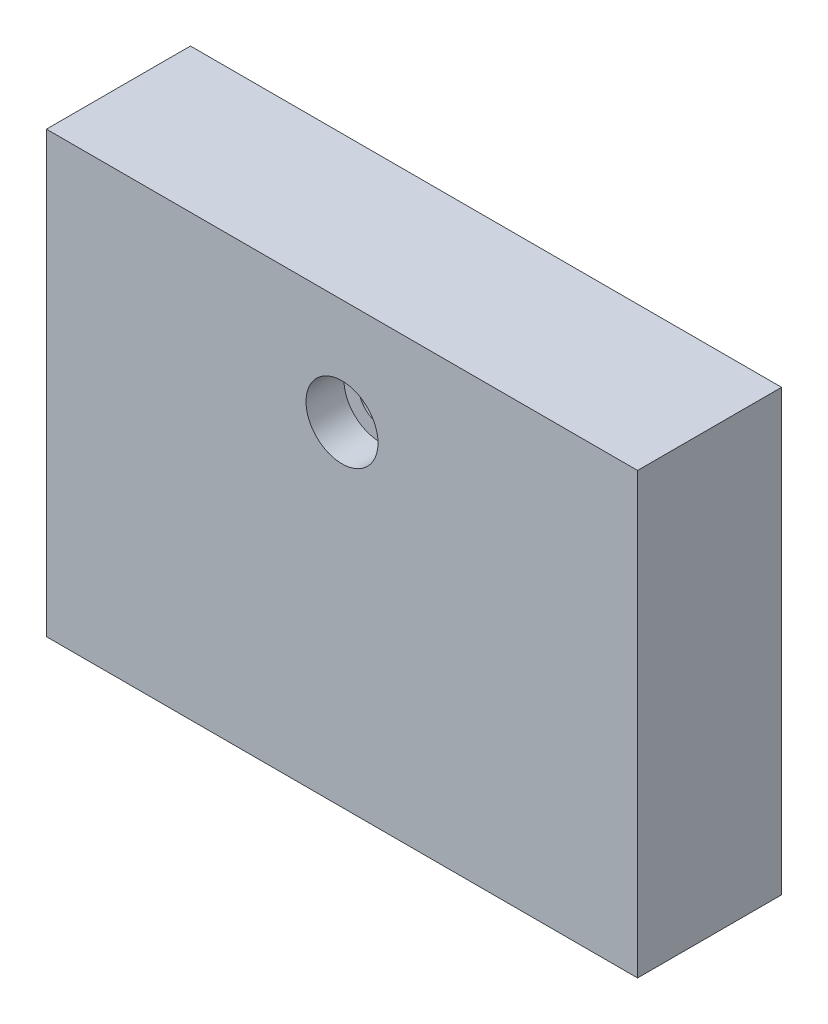
from build123d import *

# Parameters (mm, degrees)
SKETCH1_W           = 78
SKETCH1_H           = 58
BOSS_EXTRUDE1_DEPTH = 19
SKETCH2_R           = 4.75
CUT_EXTRUDE1_DEPTH  = 5
CUT_EXTRUDE2_START  = -5
SKETCH2_3_R         = 2.75
CUT_EXTRUDE2_DEPTH  = 95.040395799


with BuildPart() as part:
    # Sketch1 → Boss-Extrude1 (new body)
    with BuildSketch(Plane.XY):
        with Locations((39, 29)):
            Rectangle(SKETCH1_W, SKETCH1_H)
    extrude(amount=BOSS_EXTRUDE1_DEPTH)

    # Sketch2 → Cut-Extrude1 (cut)
    with BuildSketch(Plane.XY.offset(19)):
        with Locations((39, 44)):
            Circle(SKETCH2_R)
    extrude(amount=-CUT_EXTRUDE1_DEPTH, mode=Mode.SUBTRACT)

    # Sketch2<3> → Cut-Extrude2 (cut, through all)
    with BuildSketch(Plane.XY.offset(19).offset(CUT_EXTRUDE2_START)):
        with Locations((39, 44)):
            Circle(SKETCH2_3_R)
    extrude(amount=-CUT_EXTRUDE2_DEPTH, mode=Mode.SUBTRACT)


solid = part.part
